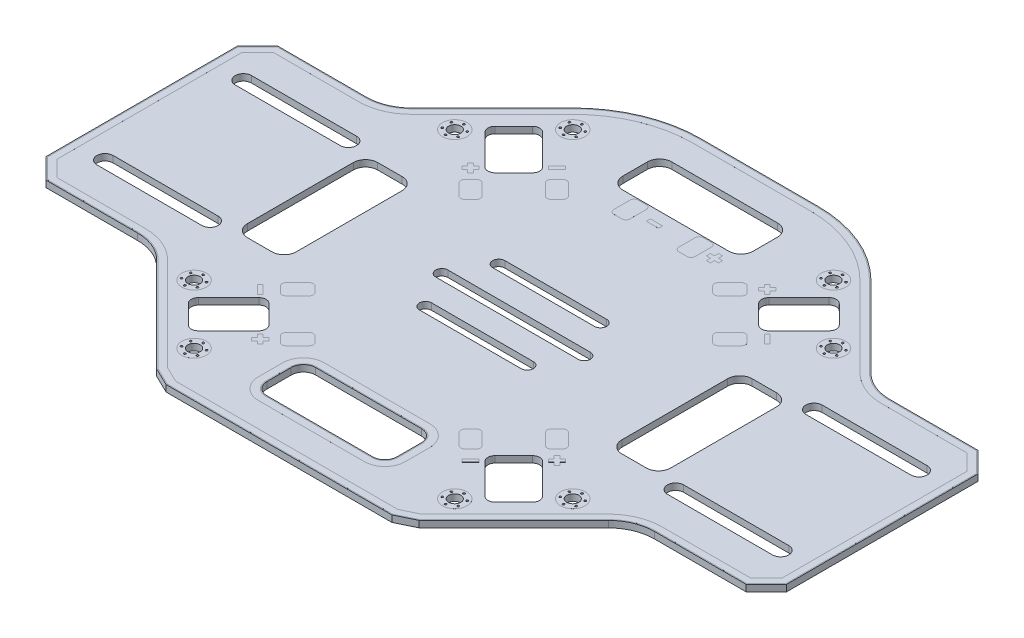
from build123d import *

# Parameters (mm, degrees)
BOSS_EXTRUDE1_DEPTH      = 0.8
BOSS_EXTRUDE1_DEPTH_BACK = 0.8
SKETCH1_R                = 1.5
SKETCH2_R                = 3
SKETCH2_R_2              = 0.25
SKETCH2_R_3              = 1.5
BOSS_EXTRUDE2_DEPTH      = 0.001
BOSS_EXTRUDE4_DEPTH      = 0.001
SKETCH6_R                = 0.25
CUT_EXTRUDE2_DEPTH       = 1.6
SKETCH7_W                = 3
SKETCH7_H                = 1
BOSS_EXTRUDE5_DEPTH      = 0.001


with BuildPart() as part:
    # Sketch1 → Boss-Extrude1 (new, two sides: drawn at the far end of the back side and taken through both)
    with BuildSketch(Plane(origin=(0, 0, 0), x_dir=(1, 0, 0), z_dir=(0, 1, 0)).offset(-BOSS_EXTRUDE1_DEPTH_BACK)):
        with BuildLine():
            Line((-27.75, -57.681401017), (27.75, -57.681401017))
            Line((27.75, -57.681401017), (32.25, -55.501951545))
            Line((32.25, -55.501951545), (55.501951545, -32.25))
            ThreePointArc((55.501951545, -32.25), (59.171487368, -29.798094552), (63.5, -28.937099858))
            Line((63.5, -28.937099858), (86, -28.937099858))
            Line((86, -28.937099858), (91, -23.937099858))
            Line((91, -23.937099858), (91, 23.062900142))
            Line((91, 23.062900142), (86, 28.062900142))
            Line((86, 28.062900142), (64.302117422, 28.062900142))
            ThreePointArc((64.302117422, 28.062900142), (60.040200145, 28.910648198), (56.427121139, 31.324830407))
            Line((56.427121139, 31.324830407), (36.628131265, 51.12382028))
            ThreePointArc((36.628131265, 51.12382028), (26.443529141, 57.928953855), (14.429971817, 60.318598983))
            Line((14.429971817, 60.318598983), (-14.429971817, 60.318598983))
            ThreePointArc((-14.429971817, 60.318598983), (-26.443529141, 57.928953855), (-36.628131265, 51.12382028))
            Line((-36.628131265, 51.12382028), (-56.427121139, 31.324830407))
            ThreePointArc((-56.427121139, 31.324830407), (-60.040200145, 28.910648198), (-64.302117422, 28.062900142))
            Line((-64.302117422, 28.062900142), (-86, 28.062900142))
            Line((-86, 28.062900142), (-91, 23.062900142))
            Line((-91, 23.062900142), (-91, -23.937099858))
            Line((-91, -23.937099858), (-86, -28.937099858))
            Line((-86, -28.937099858), (-63.5, -28.937099858))
            ThreePointArc((-63.5, -28.937099858), (-59.171487368, -29.798094552), (-55.501951545, -32.25))
            Line((-55.501951545, -32.25), (-32.25, -55.501951545))
            Line((-32.25, -55.501951545), (-27.75, -57.681401017))
        make_face()
        with Locations(Location((-32.031937188, 46.527626202, 0), (0, 0, 270))):
            Circle(SKETCH1_R, mode=Mode.SUBTRACT)
        with Locations(Location((-46.527626202, 32.031937188, 0), (0, 0, 270))):
            Circle(SKETCH1_R, mode=Mode.SUBTRACT)
        with Locations(Location((32.031937188, -46.527626202, 0), (0, 0, 270))):
            Circle(SKETCH1_R, mode=Mode.SUBTRACT)
        with Locations(Location((46.527626202, -32.031937188, 0), (0, 0, 270))):
            Circle(SKETCH1_R, mode=Mode.SUBTRACT)
        with Locations(Location((-46.527626202, -32.031937188, 0), (0, 0, 270))):
            Circle(SKETCH1_R, mode=Mode.SUBTRACT)
        with Locations(Location((-32.031937188, -46.527626202, 0), (0, 0, 270))):
            Circle(SKETCH1_R, mode=Mode.SUBTRACT)
        with Locations(Location((32.031937188, 46.527626202, 0), (0, 0, 270))):
            Circle(SKETCH1_R, mode=Mode.SUBTRACT)
        with Locations(Location((46.527626202, 32.031937188, 0), (0, 0, 270))):
            Circle(SKETCH1_R, mode=Mode.SUBTRACT)
        with BuildLine():
            Line((-13, -47.681401017), (13, -47.681401017))
            ThreePointArc((13, -47.681401017), (15.121320344, -46.802721361), (16, -44.681401017))
            Line((16, -44.681401017), (16, -38.681401017))
            ThreePointArc((16, -38.681401017), (15.121320344, -36.560080673), (13, -35.681401017))
            Line((13, -35.681401017), (-13, -35.681401017))
            ThreePointArc((-13, -35.681401017), (-15.121320344, -36.560080673), (-16, -38.681401017))
            Line((-16, -38.681401017), (-16, -44.681401017))
            ThreePointArc((-16, -44.681401017), (-15.121320344, -46.802721361), (-13, -47.681401017))
        make_face(mode=Mode.SUBTRACT)
        with BuildLine():
            Line((37.688791437, -42.284985515), (42.284985515, -37.688791437))
            ThreePointArc((42.284985515, -37.688791437), (42.797548648, -36.45135457), (42.284985515, -35.213917703))
            Line((42.284985515, -35.213917703), (34.860364312, -27.789296501))
            ThreePointArc((34.860364312, -27.789296501), (33.622927445, -27.276733368), (32.385490578, -27.789296501))
            Line((32.385490578, -27.789296501), (27.789296501, -32.385490578))
            ThreePointArc((27.789296501, -32.385490578), (27.276733368, -33.622927445), (27.789296501, -34.860364312))
            Line((27.789296501, -34.860364312), (35.213917703, -42.284985515))
            ThreePointArc((35.213917703, -42.284985515), (36.45135457, -42.797548648), (37.688791437, -42.284985515))
        make_face(mode=Mode.SUBTRACT)
        with BuildLine():
            Line((-35.213917703, -42.284985515), (-27.789296501, -34.860364312))
            ThreePointArc((-27.789296501, -34.860364312), (-27.276733368, -33.622927445), (-27.789296501, -32.385490578))
            Line((-27.789296501, -32.385490578), (-32.385490578, -27.789296501))
            ThreePointArc((-32.385490578, -27.789296501), (-33.622927445, -27.276733368), (-34.860364312, -27.789296501))
            Line((-34.860364312, -27.789296501), (-42.284985515, -35.213917703))
            ThreePointArc((-42.284985515, -35.213917703), (-42.797548648, -36.45135457), (-42.284985515, -37.688791437))
            Line((-42.284985515, -37.688791437), (-37.688791437, -42.284985515))
            ThreePointArc((-37.688791437, -42.284985515), (-36.45135457, -42.797548648), (-35.213917703, -42.284985515))
        make_face(mode=Mode.SUBTRACT)
        with BuildLine():
            Line((-35.213917703, 42.284985515), (-27.789296501, 34.860364312))
            ThreePointArc((-27.789296501, 34.860364312), (-27.276733368, 33.622927445), (-27.789296501, 32.385490578))
            Line((-27.789296501, 32.385490578), (-32.385490578, 27.789296501))
            ThreePointArc((-32.385490578, 27.789296501), (-33.622927445, 27.276733368), (-34.860364312, 27.789296501))
            Line((-34.860364312, 27.789296501), (-42.284985515, 35.213917703))
            ThreePointArc((-42.284985515, 35.213917703), (-42.797548648, 36.45135457), (-42.284985515, 37.688791437))
            Line((-42.284985515, 37.688791437), (-37.688791437, 42.284985515))
            ThreePointArc((-37.688791437, 42.284985515), (-36.45135457, 42.797548648), (-35.213917703, 42.284985515))
        make_face(mode=Mode.SUBTRACT)
        with BuildLine():
            Line((37.688791437, 42.284985515), (42.284985515, 37.688791437))
            ThreePointArc((42.284985515, 37.688791437), (42.797548648, 36.45135457), (42.284985515, 35.213917703))
            Line((42.284985515, 35.213917703), (34.860364312, 27.789296501))
            ThreePointArc((34.860364312, 27.789296501), (33.622927445, 27.276733368), (32.385490578, 27.789296501))
            Line((32.385490578, 27.789296501), (27.789296501, 32.385490578))
            ThreePointArc((27.789296501, 32.385490578), (27.276733368, 33.622927445), (27.789296501, 34.860364312))
            Line((27.789296501, 34.860364312), (35.213917703, 42.284985515))
            ThreePointArc((35.213917703, 42.284985515), (36.45135457, 42.797548648), (37.688791437, 42.284985515))
        make_face(mode=Mode.SUBTRACT)
        with BuildLine():
            Line((-13, 51.818598983), (13, 51.818598983))
            ThreePointArc((13, 51.818598983), (15.121320344, 50.939919327), (16, 48.818598983))
            Line((16, 48.818598983), (16, 42.818598983))
            ThreePointArc((16, 42.818598983), (15.121320344, 40.697278639), (13, 39.818598983))
            Line((13, 39.818598983), (-13, 39.818598983))
            ThreePointArc((-13, 39.818598983), (-15.121320344, 40.697278639), (-16, 42.818598983))
            Line((-16, 42.818598983), (-16, 48.818598983))
            ThreePointArc((-16, 48.818598983), (-15.121320344, 50.939919327), (-13, 51.818598983))
        make_face(mode=Mode.SUBTRACT)
        with BuildLine():
            Line((-12.5, -10.681401017), (12.5, -10.681401017))
            ThreePointArc((12.5, -10.681401017), (14, -9.181401017), (12.5, -7.681401017))
            Line((12.5, -7.681401017), (-12.5, -7.681401017))
            ThreePointArc((-12.5, -7.681401017), (-14, -9.181401017), (-12.5, -10.681401017))
        make_face(mode=Mode.SUBTRACT)
        with BuildLine():
            Line((-17.5, -1.681401017), (17.5, -1.681401017))
            ThreePointArc((17.5, -1.681401017), (19, -0.181401017), (17.5, 1.318598983))
            Line((17.5, 1.318598983), (-17.5, 1.318598983))
            ThreePointArc((-17.5, 1.318598983), (-19, -0.181401017), (-17.5, -1.681401017))
        make_face(mode=Mode.SUBTRACT)
        with BuildLine():
            Line((-12.5, 7.318598983), (12.5, 7.318598983))
            ThreePointArc((12.5, 7.318598983), (14, 8.818598983), (12.5, 10.318598983))
            Line((12.5, 10.318598983), (-12.5, 10.318598983))
            ThreePointArc((-12.5, 10.318598983), (-14, 8.818598983), (-12.5, 7.318598983))
        make_face(mode=Mode.SUBTRACT)
        with BuildLine():
            Line((-52, 12.562900142), (-52, -13.437099858))
            ThreePointArc((-52, -13.437099858), (-51.121320344, -15.558420201), (-49, -16.437099858))
            Line((-49, -16.437099858), (-43, -16.437099858))
            ThreePointArc((-43, -16.437099858), (-40.878679656, -15.558420201), (-40, -13.437099858))
            Line((-40, -13.437099858), (-40, 12.562900142))
            ThreePointArc((-40, 12.562900142), (-40.878679656, 14.684220486), (-43, 15.562900142))
            Line((-43, 15.562900142), (-49, 15.562900142))
            ThreePointArc((-49, 15.562900142), (-51.121320344, 14.684220486), (-52, 12.562900142))
        make_face(mode=Mode.SUBTRACT)
        with BuildLine():
            Line((52, 12.562900142), (52, -13.437099858))
            ThreePointArc((52, -13.437099858), (51.121320344, -15.558420201), (49, -16.437099858))
            Line((49, -16.437099858), (43, -16.437099858))
            ThreePointArc((43, -16.437099858), (40.878679656, -15.558420201), (40, -13.437099858))
            Line((40, -13.437099858), (40, 12.562900142))
            ThreePointArc((40, 12.562900142), (40.878679656, 14.684220486), (43, 15.562900142))
            Line((43, 15.562900142), (49, 15.562900142))
            ThreePointArc((49, 15.562900142), (51.121320344, 14.684220486), (52, 12.562900142))
        make_face(mode=Mode.SUBTRACT)
        with BuildLine():
            Line((-83, 18.562900142), (-57.2, 18.562900142))
            ThreePointArc((-57.2, 18.562900142), (-55.2, 16.562900142), (-57.2, 14.562900142))
            Line((-57.2, 14.562900142), (-83, 14.562900142))
            ThreePointArc((-83, 14.562900142), (-85, 16.562900142), (-83, 18.562900142))
        make_face(mode=Mode.SUBTRACT)
        with BuildLine():
            Line((-83, -15.437099858), (-57.2, -15.437099858))
            ThreePointArc((-57.2, -15.437099858), (-55.2, -17.437099858), (-57.2, -19.437099858))
            Line((-57.2, -19.437099858), (-83, -19.437099858))
            ThreePointArc((-83, -19.437099858), (-85, -17.437099858), (-83, -15.437099858))
        make_face(mode=Mode.SUBTRACT)
        with BuildLine():
            Line((57.2, -15.437099858), (83, -15.437099858))
            ThreePointArc((83, -15.437099858), (85, -17.437099858), (83, -19.437099858))
            Line((83, -19.437099858), (57.2, -19.437099858))
            ThreePointArc((57.2, -19.437099858), (55.2, -17.437099858), (57.2, -15.437099858))
        make_face(mode=Mode.SUBTRACT)
        with BuildLine():
            Line((57.2, 18.562900142), (83, 18.562900142))
            ThreePointArc((83, 18.562900142), (85, 16.562900142), (83, 14.562900142))
            Line((83, 14.562900142), (57.2, 14.562900142))
            ThreePointArc((57.2, 14.562900142), (55.2, 16.562900142), (57.2, 18.562900142))
        make_face(mode=Mode.SUBTRACT)
    extrude(amount=BOSS_EXTRUDE1_DEPTH + BOSS_EXTRUDE1_DEPTH_BACK)

    # Sketch2 → Boss-Extrude2 (add)
    # profile 1 of 10: a face of its own
    with BuildSketch(Plane(origin=(0, 0.8, 0), x_dir=(1, 0, 0), z_dir=(0, 1, 0))):
        with BuildLine():
            ThreePointArc((56.250344443, 31.148053711), (59.944529287, 28.679678315), (64.302117422, 27.812900142))
            Line((64.302117422, 27.812900142), (85.896446609, 27.812900142))
            Line((85.896446609, 27.812900142), (90.75, 22.959346752))
            Line((90.75, 22.959346752), (90.75, -23.833546467))
            Line((90.75, -23.833546467), (85.896446609, -28.687099858))
            Line((85.896446609, -28.687099858), (63.5, -28.687099858))
            ThreePointArc((63.5, -28.687099858), (59.075816509, -29.567124669), (55.32517485, -32.073223305))
            Line((55.32517485, -32.073223305), (32.10305631, -55.295341845))
            Line((32.10305631, -55.295341845), (27.692646067, -57.431401017))
            Line((27.692646067, -57.431401017), (-27.692646067, -57.431401017))
            Line((-27.692646067, -57.431401017), (-32.10305631, -55.295341845))
            Line((-32.10305631, -55.295341845), (-55.32517485, -32.073223305))
            ThreePointArc((-55.32517485, -32.073223305), (-59.075816509, -29.567124669), (-63.5, -28.687099858))
            Line((-63.5, -28.687099858), (-85.896446609, -28.687099858))
            Line((-85.896446609, -28.687099858), (-90.75, -23.833546467))
            Line((-90.75, -23.833546467), (-90.75, 22.959346752))
            Line((-90.75, 22.959346752), (-85.896446609, 27.812900142))
            Line((-85.896446609, 27.812900142), (-64.302117422, 27.812900142))
            ThreePointArc((-64.302117422, 27.812900142), (-59.944529287, 28.679678315), (-56.250344443, 31.148053711))
            Line((-56.250344443, 31.148053711), (-36.45135457, 50.947043584))
            ThreePointArc((-36.45135457, 50.947043584), (-26.347858283, 57.697983972), (-14.429971817, 60.068598983))
            Line((-14.429971817, 60.068598983), (14.429971817, 60.068598983))
            ThreePointArc((14.429971817, 60.068598983), (26.347858283, 57.697983972), (36.45135457, 50.947043584))
            Line((36.45135457, 50.947043584), (56.250344443, 31.148053711))
        make_face()
        with BuildLine():
            Line((-85.212994231, 26.162900142), (-64.302117422, 26.162900142))
            ThreePointArc((-64.302117422, 26.162900142), (-59.313101623, 27.155277086), (-55.083618254, 29.981327522))
            Line((-55.083618254, 29.981327522), (-35.284628381, 49.780317396))
            ThreePointArc((-35.284628381, 49.780317396), (-25.71643062, 56.173582743), (-14.429971817, 58.418598983))
            Line((-14.429971817, 58.418598983), (14.429971817, 58.418598983))
            ThreePointArc((14.429971817, 58.418598983), (25.71643062, 56.173582743), (35.284628381, 49.780317396))
            Line((35.284628381, 49.780317396), (55.083618254, 29.981327522))
            ThreePointArc((55.083618254, 29.981327522), (59.313101623, 27.155277086), (64.302117422, 26.162900142))
            Line((64.302117422, 26.162900142), (85.212994231, 26.162900142))
            Line((85.212994231, 26.162900142), (89.1, 22.275894374))
            Line((89.1, 22.275894374), (89.1, -23.150094089))
            Line((89.1, -23.150094089), (85.212994231, -27.037099858))
            Line((85.212994231, -27.037099858), (63.5, -27.037099858))
            ThreePointArc((63.5, -27.037099858), (58.444388846, -28.042723441), (54.158448661, -30.906497116))
            Line((54.158448661, -30.906497116), (31.133227955, -53.931717821))
            Line((31.133227955, -53.931717821), (27.314110106, -55.781401017))
            Line((27.314110106, -55.781401017), (-27.314110106, -55.781401017))
            Line((-27.314110106, -55.781401017), (-31.133227955, -53.931717821))
            Line((-31.133227955, -53.931717821), (-54.158448661, -30.906497116))
            ThreePointArc((-54.158448661, -30.906497116), (-58.444388846, -28.042723441), (-63.5, -27.037099858))
            Line((-63.5, -27.037099858), (-85.212994231, -27.037099858))
            Line((-85.212994231, -27.037099858), (-89.1, -23.150094089))
            Line((-89.1, -23.150094089), (-89.1, 22.275894374))
            Line((-89.1, 22.275894374), (-85.212994231, 26.162900142))
        make_face(mode=Mode.SUBTRACT)
    # profile 2 of 10: a face of its own
    with BuildSketch(Plane(origin=(0, 0.8, 0), x_dir=(1, 0, 0), z_dir=(0, 1, 0))):
        with Locations(Location((-32.031937188, -46.527626202, 0), (0, 0, 270))):
            Circle(SKETCH2_R)
        with Locations(Location((-33.980494346, -45.402626202, 0), (0, 0, 270))):
            Circle(SKETCH2_R_2, mode=Mode.SUBTRACT)
        with Locations(Location((-33.980494346, -47.652626202, 0), (0, 0, 270))):
            Circle(SKETCH2_R_2, mode=Mode.SUBTRACT)
        with Locations(Location((-32.031937188, -48.777626202, 0), (0, 0, 270))):
            Circle(SKETCH2_R_2, mode=Mode.SUBTRACT)
        with Locations(Location((-30.083380029, -47.652626202, 0), (0, 0, 270))):
            Circle(SKETCH2_R_2, mode=Mode.SUBTRACT)
        with Locations(Location((-30.083380029, -45.402626202, 0), (0, 0, 270))):
            Circle(SKETCH2_R_2, mode=Mode.SUBTRACT)
        with Locations(Location((-32.031937188, -44.277626202, 0), (0, 0, 270))):
            Circle(SKETCH2_R_2, mode=Mode.SUBTRACT)
        with Locations(Location((-32.031937188, -46.527626202, 0), (0, 0, 270))):
            Circle(SKETCH2_R_3, mode=Mode.SUBTRACT)
    # profile 3 of 10: a face of its own
    with BuildSketch(Plane(origin=(0, 0.8, 0), x_dir=(1, 0, 0), z_dir=(0, 1, 0))):
        with Locations(Location((-46.527626202, -32.031937188, 0), (0, 0, 270))):
            Circle(SKETCH2_R)
        with Locations(Location((-48.476183361, -30.906937188, 0), (0, 0, 270))):
            Circle(SKETCH2_R_2, mode=Mode.SUBTRACT)
        with Locations(Location((-48.476183361, -33.156937188, 0), (0, 0, 270))):
            Circle(SKETCH2_R_2, mode=Mode.SUBTRACT)
        with Locations(Location((-46.527626202, -34.281937188, 0), (0, 0, 270))):
            Circle(SKETCH2_R_2, mode=Mode.SUBTRACT)
        with Locations(Location((-44.579069044, -33.156937188, 0), (0, 0, 270))):
            Circle(SKETCH2_R_2, mode=Mode.SUBTRACT)
        with Locations(Location((-44.579069044, -30.906937188, 0), (0, 0, 270))):
            Circle(SKETCH2_R_2, mode=Mode.SUBTRACT)
        with Locations(Location((-46.527626202, -29.781937188, 0), (0, 0, 270))):
            Circle(SKETCH2_R_2, mode=Mode.SUBTRACT)
        with Locations(Location((-46.527626202, -32.031937188, 0), (0, 0, 270))):
            Circle(SKETCH2_R_3, mode=Mode.SUBTRACT)
    # profile 4 of 10: a face of its own
    with BuildSketch(Plane(origin=(0, 0.8, 0), x_dir=(1, 0, 0), z_dir=(0, 1, 0))):
        with Locations(Location((-46.527626202, 32.031937188, 0), (0, 0, 270))):
            Circle(SKETCH2_R)
        with Locations(Location((-48.476183361, 30.906937188, 0), (0, 0, 270))):
            Circle(SKETCH2_R_2, mode=Mode.SUBTRACT)
        with Locations(Location((-48.476183361, 33.156937188, 0), (0, 0, 270))):
            Circle(SKETCH2_R_2, mode=Mode.SUBTRACT)
        with Locations(Location((-46.527626202, 34.281937188, 0), (0, 0, 270))):
            Circle(SKETCH2_R_2, mode=Mode.SUBTRACT)
        with Locations(Location((-44.579069044, 33.156937188, 0), (0, 0, 270))):
            Circle(SKETCH2_R_2, mode=Mode.SUBTRACT)
        with Locations(Location((-44.579069044, 30.906937188, 0), (0, 0, 270))):
            Circle(SKETCH2_R_2, mode=Mode.SUBTRACT)
        with Locations(Location((-46.527626202, 29.781937188, 0), (0, 0, 270))):
            Circle(SKETCH2_R_2, mode=Mode.SUBTRACT)
        with Locations(Location((-46.527626202, 32.031937188, 0), (0, 0, 270))):
            Circle(SKETCH2_R_3, mode=Mode.SUBTRACT)
    # profile 5 of 10: a face of its own
    with BuildSketch(Plane(origin=(0, 0.8, 0), x_dir=(1, 0, 0), z_dir=(0, 1, 0))):
        with Locations(Location((-32.031937188, 46.527626202, 0), (0, 0, 270))):
            Circle(SKETCH2_R)
        with Locations(Location((-33.980494346, 45.402626202, 0), (0, 0, 270))):
            Circle(SKETCH2_R_2, mode=Mode.SUBTRACT)
        with Locations(Location((-33.980494346, 47.652626202, 0), (0, 0, 270))):
            Circle(SKETCH2_R_2, mode=Mode.SUBTRACT)
        with Locations(Location((-32.031937188, 44.277626202, 0), (0, 0, 270))):
            Circle(SKETCH2_R_2, mode=Mode.SUBTRACT)
        with Locations(Location((-30.083380029, 45.402626202, 0), (0, 0, 270))):
            Circle(SKETCH2_R_2, mode=Mode.SUBTRACT)
        with Locations(Location((-30.083380029, 47.652626202, 0), (0, 0, 270))):
            Circle(SKETCH2_R_2, mode=Mode.SUBTRACT)
        with Locations(Location((-32.031937188, 48.777626202, 0), (0, 0, 270))):
            Circle(SKETCH2_R_2, mode=Mode.SUBTRACT)
        with Locations(Location((-32.031937188, 46.527626202, 0), (0, 0, 270))):
            Circle(SKETCH2_R_3, mode=Mode.SUBTRACT)
    # profile 6 of 10: a face of its own
    with BuildSketch(Plane(origin=(0, 0.8, 0), x_dir=(1, 0, 0), z_dir=(0, 1, 0))):
        with Locations(Location((32.031937188, 46.527626202, 0), (0, 0, 270))):
            Circle(SKETCH2_R)
        with Locations(Location((30.083380029, 45.402626202, 0), (0, 0, 270))):
            Circle(SKETCH2_R_2, mode=Mode.SUBTRACT)
        with Locations(Location((30.083380029, 47.652626202, 0), (0, 0, 270))):
            Circle(SKETCH2_R_2, mode=Mode.SUBTRACT)
        with Locations(Location((32.031937188, 48.777626202, 0), (0, 0, 270))):
            Circle(SKETCH2_R_2, mode=Mode.SUBTRACT)
        with Locations(Location((33.980494346, 47.652626202, 0), (0, 0, 270))):
            Circle(SKETCH2_R_2, mode=Mode.SUBTRACT)
        with Locations(Location((33.980494346, 45.402626202, 0), (0, 0, 270))):
            Circle(SKETCH2_R_2, mode=Mode.SUBTRACT)
        with Locations(Location((32.031937188, 44.277626202, 0), (0, 0, 270))):
            Circle(SKETCH2_R_2, mode=Mode.SUBTRACT)
        with Locations(Location((32.031937188, 46.527626202, 0), (0, 0, 270))):
            Circle(SKETCH2_R_3, mode=Mode.SUBTRACT)
    # profile 7 of 10: a face of its own
    with BuildSketch(Plane(origin=(0, 0.8, 0), x_dir=(1, 0, 0), z_dir=(0, 1, 0))):
        with Locations(Location((46.527626202, 32.031937188, 0), (0, 0, 270))):
            Circle(SKETCH2_R)
        with Locations(Location((44.579069044, 30.906937188, 0), (0, 0, 270))):
            Circle(SKETCH2_R_2, mode=Mode.SUBTRACT)
        with Locations(Location((44.579069044, 33.156937188, 0), (0, 0, 270))):
            Circle(SKETCH2_R_2, mode=Mode.SUBTRACT)
        with Locations(Location((46.527626202, 34.281937188, 0), (0, 0, 270))):
            Circle(SKETCH2_R_2, mode=Mode.SUBTRACT)
        with Locations(Location((48.476183361, 33.156937188, 0), (0, 0, 270))):
            Circle(SKETCH2_R_2, mode=Mode.SUBTRACT)
        with Locations(Location((48.476183361, 30.906937188, 0), (0, 0, 270))):
            Circle(SKETCH2_R_2, mode=Mode.SUBTRACT)
        with Locations(Location((46.527626202, 29.781937188, 0), (0, 0, 270))):
            Circle(SKETCH2_R_2, mode=Mode.SUBTRACT)
        with Locations(Location((46.527626202, 32.031937188, 0), (0, 0, 270))):
            Circle(SKETCH2_R_3, mode=Mode.SUBTRACT)
    # profile 8 of 10: a face of its own
    with BuildSketch(Plane(origin=(0, 0.8, 0), x_dir=(1, 0, 0), z_dir=(0, 1, 0))):
        with Locations(Location((46.527626202, -32.031937188, 0), (0, 0, 270))):
            Circle(SKETCH2_R)
        with Locations(Location((44.579069044, -33.156937188, 0), (0, 0, 270))):
            Circle(SKETCH2_R_2, mode=Mode.SUBTRACT)
        with Locations(Location((44.579069044, -30.906937188, 0), (0, 0, 270))):
            Circle(SKETCH2_R_2, mode=Mode.SUBTRACT)
        with Locations(Location((46.527626202, -29.781937188, 0), (0, 0, 270))):
            Circle(SKETCH2_R_2, mode=Mode.SUBTRACT)
        with Locations(Location((48.476183361, -30.906937188, 0), (0, 0, 270))):
            Circle(SKETCH2_R_2, mode=Mode.SUBTRACT)
        with Locations(Location((48.476183361, -33.156937188, 0), (0, 0, 270))):
            Circle(SKETCH2_R_2, mode=Mode.SUBTRACT)
        with Locations(Location((46.527626202, -34.281937188, 0), (0, 0, 270))):
            Circle(SKETCH2_R_2, mode=Mode.SUBTRACT)
        with Locations(Location((46.527626202, -32.031937188, 0), (0, 0, 270))):
            Circle(SKETCH2_R_3, mode=Mode.SUBTRACT)
    # profile 9 of 10: a face of its own
    with BuildSketch(Plane(origin=(0, 0.8, 0), x_dir=(1, 0, 0), z_dir=(0, 1, 0))):
        with Locations(Location((32.031937188, -46.527626202, 0), (0, 0, 270))):
            Circle(SKETCH2_R)
        with Locations(Location((30.083380029, -45.402626202, 0), (0, 0, 270))):
            Circle(SKETCH2_R_2, mode=Mode.SUBTRACT)
        with Locations(Location((30.083380029, -47.652626202, 0), (0, 0, 270))):
            Circle(SKETCH2_R_2, mode=Mode.SUBTRACT)
        with Locations(Location((32.031937188, -48.777626202, 0), (0, 0, 270))):
            Circle(SKETCH2_R_2, mode=Mode.SUBTRACT)
        with Locations(Location((33.980494346, -47.652626202, 0), (0, 0, 270))):
            Circle(SKETCH2_R_2, mode=Mode.SUBTRACT)
        with Locations(Location((33.980494346, -45.402626202, 0), (0, 0, 270))):
            Circle(SKETCH2_R_2, mode=Mode.SUBTRACT)
        with Locations(Location((32.031937188, -44.277626202, 0), (0, 0, 270))):
            Circle(SKETCH2_R_2, mode=Mode.SUBTRACT)
        with Locations(Location((32.031937188, -46.527626202, 0), (0, 0, 270))):
            Circle(SKETCH2_R_3, mode=Mode.SUBTRACT)
    # profile 10 of 10: a face of its own
    with BuildSketch(Plane(origin=(0, 0.8, 0), x_dir=(1, 0, 0), z_dir=(0, 1, 0))):
        with BuildLine():
            Line((-13, -33.631401017), (13, -33.631401017))
            ThreePointArc((13, -33.631401017), (16.570889245, -35.110511772), (18.05, -38.681401017))
            Line((18.05, -38.681401017), (18.05, -44.681401017))
            ThreePointArc((18.05, -44.681401017), (16.570889245, -48.252290262), (13, -49.731401017))
            Line((13, -49.731401017), (-13, -49.731401017))
            ThreePointArc((-13, -49.731401017), (-16.570889245, -48.252290262), (-18.05, -44.681401017))
            Line((-18.05, -44.681401017), (-18.05, -38.681401017))
            ThreePointArc((-18.05, -38.681401017), (-16.570889245, -35.110511772), (-13, -33.631401017))
        make_face()
        with BuildLine():
            ThreePointArc((13, -47.931401017), (15.298097039, -46.979498056), (16.25, -44.681401017))
            Line((16.25, -44.681401017), (16.25, -38.681401017))
            ThreePointArc((16.25, -38.681401017), (15.298097039, -36.383303978), (13, -35.431401017))
            Line((13, -35.431401017), (-13, -35.431401017))
            ThreePointArc((-13, -35.431401017), (-15.298097039, -36.383303978), (-16.25, -38.681401017))
            Line((-16.25, -38.681401017), (-16.25, -44.681401017))
            ThreePointArc((-16.25, -44.681401017), (-15.298097039, -46.979498056), (-13, -47.931401017))
            Line((-13, -47.931401017), (13, -47.931401017))
        make_face(mode=Mode.SUBTRACT)
    boss_extrude2 = extrude(amount=BOSS_EXTRUDE2_DEPTH)

    # Mirror1: Boss-Extrude2 across plane
    add(boss_extrude2.mirror(Plane.ZX))

    # Sketch5 → Boss-Extrude4 (add)
    with BuildSketch(Plane(origin=(0, 0.8, 0), x_dir=(1, 0, 0), z_dir=(0, 1, 0))):
        Polygon((35.744247789, -27.258966415), (36.45135457, -26.551859634), (37.158461351, -27.258966415), (37.865568133, -26.551859634), (37.158461351, -25.844752852), (37.865568133, -25.137646071), (37.158461351, -24.43053929), (36.45135457, -25.137646071), (35.744247789, -24.43053929), (35.037141008, -25.137646071), (35.744247789, -25.844752852), (35.037141008, -26.551859634), align=None)
        Polygon((26.551859634, -35.037141008), (27.258966415, -35.744247789), (25.137646071, -37.865568133), (24.43053929, -37.158461351), align=None)
        Polygon((-37.158461351, -24.43053929), (-37.865568133, -25.137646071), (-35.744247789, -27.258966415), (-35.037141008, -26.551859634), align=None)
        Polygon((-26.551859634, -35.037141008), (-27.258966415, -35.744247789), (-26.551859634, -36.45135457), (-27.258966415, -37.158461351), (-26.551859634, -37.865568133), (-25.844752852, -37.158461351), (-25.137646071, -37.865568133), (-24.43053929, -37.158461351), (-25.137646071, -36.45135457), (-24.43053929, -35.744247789), (-25.137646071, -35.037141008), (-25.844752852, -35.744247789), align=None)
        Polygon((-24.43053929, 37.158461351), (-25.137646071, 37.865568133), (-27.258966415, 35.744247789), (-26.551859634, 35.037141008), align=None)
        Polygon((-35.037141008, 26.551859634), (-35.744247789, 27.258966415), (-36.45135457, 26.551859634), (-37.158461351, 27.258966415), (-37.865568133, 26.551859634), (-37.158461351, 25.844752852), (-37.865568133, 25.137646071), (-37.158461351, 24.43053929), (-36.45135457, 25.137646071), (-35.744247789, 24.43053929), (-35.037141008, 25.137646071), (-35.744247789, 25.844752852), align=None)
        Polygon((37.158461351, 24.43053929), (37.865568133, 25.137646071), (35.744247789, 27.258966415), (35.037141008, 26.551859634), align=None)
        Polygon((26.551859634, 35.037141008), (27.258966415, 35.744247789), (26.551859634, 36.45135457), (27.258966415, 37.158461351), (26.551859634, 37.865568133), (25.844752852, 37.158461351), (25.137646071, 37.865568133), (24.43053929, 37.158461351), (25.137646071, 36.45135457), (24.43053929, 35.744247789), (25.137646071, 35.037141008), (25.844752852, 35.744247789), align=None)
        with BuildLine():
            Line((29.026733368, -19.834345212), (30.44094693, -18.42013165))
            ThreePointArc((30.44094693, -18.42013165), (31.148053711, -18.127238431), (31.855160492, -18.42013165))
            Line((31.855160492, -18.42013165), (34.683587617, -21.248558775))
            ThreePointArc((34.683587617, -21.248558775), (34.976480836, -21.955665556), (34.683587617, -22.662772337))
            Line((34.683587617, -22.662772337), (33.269374055, -24.076985899))
            ThreePointArc((33.269374055, -24.076985899), (32.562267274, -24.369879118), (31.855160492, -24.076985899))
            Line((31.855160492, -24.076985899), (29.026733368, -21.248558775))
            ThreePointArc((29.026733368, -21.248558775), (28.733840149, -20.541451993), (29.026733368, -19.834345212))
        make_face()
        with BuildLine():
            Line((18.42013165, -31.855160492), (21.248558775, -34.683587617))
            ThreePointArc((21.248558775, -34.683587617), (21.955665556, -34.976480836), (22.662772337, -34.683587617))
            Line((22.662772337, -34.683587617), (24.076985899, -33.269374055))
            ThreePointArc((24.076985899, -33.269374055), (24.369879118, -32.562267274), (24.076985899, -31.855160492))
            Line((24.076985899, -31.855160492), (21.248558775, -29.026733368))
            ThreePointArc((21.248558775, -29.026733368), (20.541451993, -28.733840149), (19.834345212, -29.026733368))
            Line((19.834345212, -29.026733368), (18.42013165, -30.44094693))
            ThreePointArc((18.42013165, -30.44094693), (18.127238431, -31.148053711), (18.42013165, -31.855160492))
        make_face()
        with BuildLine():
            Line((-34.683587617, -22.662772337), (-33.269374055, -24.076985899))
            ThreePointArc((-33.269374055, -24.076985899), (-32.562267274, -24.369879118), (-31.855160492, -24.076985899))
            Line((-31.855160492, -24.076985899), (-29.026733368, -21.248558775))
            ThreePointArc((-29.026733368, -21.248558775), (-28.733840149, -20.541451993), (-29.026733368, -19.834345212))
            Line((-29.026733368, -19.834345212), (-30.44094693, -18.42013165))
            ThreePointArc((-30.44094693, -18.42013165), (-31.148053711, -18.127238431), (-31.855160492, -18.42013165))
            Line((-31.855160492, -18.42013165), (-34.683587617, -21.248558775))
            ThreePointArc((-34.683587617, -21.248558775), (-34.976480836, -21.955665556), (-34.683587617, -22.662772337))
        make_face()
        with BuildLine():
            Line((-21.248558775, -29.026733368), (-24.076985899, -31.855160492))
            ThreePointArc((-24.076985899, -31.855160492), (-24.369879118, -32.562267274), (-24.076985899, -33.269374055))
            Line((-24.076985899, -33.269374055), (-22.662772337, -34.683587617))
            ThreePointArc((-22.662772337, -34.683587617), (-21.955665556, -34.976480836), (-21.248558775, -34.683587617))
            Line((-21.248558775, -34.683587617), (-18.42013165, -31.855160492))
            ThreePointArc((-18.42013165, -31.855160492), (-18.127238431, -31.148053711), (-18.42013165, -30.44094693))
            Line((-18.42013165, -30.44094693), (-19.834345212, -29.026733368))
            ThreePointArc((-19.834345212, -29.026733368), (-20.541451993, -28.733840149), (-21.248558775, -29.026733368))
        make_face()
        with BuildLine():
            Line((-22.662772337, 34.683587617), (-24.076985899, 33.269374055))
            ThreePointArc((-24.076985899, 33.269374055), (-24.369879118, 32.562267274), (-24.076985899, 31.855160492))
            Line((-24.076985899, 31.855160492), (-21.248558775, 29.026733368))
            ThreePointArc((-21.248558775, 29.026733368), (-20.541451993, 28.733840149), (-19.834345212, 29.026733368))
            Line((-19.834345212, 29.026733368), (-18.42013165, 30.44094693))
            ThreePointArc((-18.42013165, 30.44094693), (-18.127238431, 31.148053711), (-18.42013165, 31.855160492))
            Line((-18.42013165, 31.855160492), (-21.248558775, 34.683587617))
            ThreePointArc((-21.248558775, 34.683587617), (-21.955665556, 34.976480836), (-22.662772337, 34.683587617))
        make_face()
        with BuildLine():
            Line((-29.026733368, 21.248558775), (-31.855160492, 24.076985899))
            ThreePointArc((-31.855160492, 24.076985899), (-32.562267274, 24.369879118), (-33.269374055, 24.076985899))
            Line((-33.269374055, 24.076985899), (-34.683587617, 22.662772337))
            ThreePointArc((-34.683587617, 22.662772337), (-34.976480836, 21.955665556), (-34.683587617, 21.248558775))
            Line((-34.683587617, 21.248558775), (-31.855160492, 18.42013165))
            ThreePointArc((-31.855160492, 18.42013165), (-31.148053711, 18.127238431), (-30.44094693, 18.42013165))
            Line((-30.44094693, 18.42013165), (-29.026733368, 19.834345212))
            ThreePointArc((-29.026733368, 19.834345212), (-28.733840149, 20.541451993), (-29.026733368, 21.248558775))
        make_face()
        with BuildLine():
            Line((34.683587617, 22.662772337), (33.269374055, 24.076985899))
            ThreePointArc((33.269374055, 24.076985899), (32.562267274, 24.369879118), (31.855160492, 24.076985899))
            Line((31.855160492, 24.076985899), (29.026733368, 21.248558775))
            ThreePointArc((29.026733368, 21.248558775), (28.733840149, 20.541451993), (29.026733368, 19.834345212))
            Line((29.026733368, 19.834345212), (30.44094693, 18.42013165))
            ThreePointArc((30.44094693, 18.42013165), (31.148053711, 18.127238431), (31.855160492, 18.42013165))
            Line((31.855160492, 18.42013165), (34.683587617, 21.248558775))
            ThreePointArc((34.683587617, 21.248558775), (34.976480836, 21.955665556), (34.683587617, 22.662772337))
        make_face()
        with BuildLine():
            Line((21.248558775, 29.026733368), (24.076985899, 31.855160492))
            ThreePointArc((24.076985899, 31.855160492), (24.369879118, 32.562267274), (24.076985899, 33.269374055))
            Line((24.076985899, 33.269374055), (22.662772337, 34.683587617))
            ThreePointArc((22.662772337, 34.683587617), (21.955665556, 34.976480836), (21.248558775, 34.683587617))
            Line((21.248558775, 34.683587617), (18.42013165, 31.855160492))
            ThreePointArc((18.42013165, 31.855160492), (18.127238431, 31.148053711), (18.42013165, 30.44094693))
            Line((18.42013165, 30.44094693), (19.834345212, 29.026733368))
            ThreePointArc((19.834345212, 29.026733368), (20.541451993, 28.733840149), (21.248558775, 29.026733368))
        make_face()
    extrude(amount=BOSS_EXTRUDE4_DEPTH)

    # Sketch6 → Cut-Extrude2 (cut)
    with BuildSketch(Plane(origin=(0, 0.8, 0), x_dir=(1, 0, 0), z_dir=(0, 1, 0))):
        with Locations(Location((-48.476183361, 33.156937188, 0), (0, 0, 270))):
            Circle(SKETCH6_R)
        with Locations(Location((-46.527626202, 34.281937188, 0), (0, 0, 270))):
            Circle(SKETCH6_R)
        with Locations(Location((-44.579069044, 33.156937188, 0), (0, 0, 270))):
            Circle(SKETCH6_R)
        with Locations(Location((-48.476183361, 30.906937188, 0), (0, 0, 270))):
            Circle(SKETCH6_R)
        with Locations(Location((-46.527626202, 29.781937188, 0), (0, 0, 270))):
            Circle(SKETCH6_R)
        with Locations(Location((-44.579069044, 30.906937188, 0), (0, 0, 270))):
            Circle(SKETCH6_R)
        with Locations(Location((-33.980494346, 45.402626202, 0), (0, 0, 270))):
            Circle(SKETCH6_R)
        with Locations(Location((-32.031937188, 48.777626202, 0), (0, 0, 270))):
            Circle(SKETCH6_R)
        with Locations(Location((-33.980494346, 47.652626202, 0), (0, 0, 270))):
            Circle(SKETCH6_R)
        with Locations(Location((-32.031937188, 44.277626202, 0), (0, 0, 270))):
            Circle(SKETCH6_R)
        with Locations(Location((-30.083380029, 47.652626202, 0), (0, 0, 270))):
            Circle(SKETCH6_R)
        with Locations(Location((-30.083380029, 45.402626202, 0), (0, 0, 270))):
            Circle(SKETCH6_R)
        with Locations(Location((30.083380029, 47.652626202, 0), (0, 0, 270))):
            Circle(SKETCH6_R)
        with Locations(Location((32.031937188, 48.777626202, 0), (0, 0, 270))):
            Circle(SKETCH6_R)
        with Locations(Location((33.980494346, 47.652626202, 0), (0, 0, 270))):
            Circle(SKETCH6_R)
        with Locations(Location((33.980494346, 45.402626202, 0), (0, 0, 270))):
            Circle(SKETCH6_R)
        with Locations(Location((30.083380029, 45.402626202, 0), (0, 0, 270))):
            Circle(SKETCH6_R)
        with Locations(Location((32.031937188, 44.277626202, 0), (0, 0, 270))):
            Circle(SKETCH6_R)
        with Locations(Location((46.527626202, 34.281937188, 0), (0, 0, 270))):
            Circle(SKETCH6_R)
        with Locations(Location((48.476183361, 30.906937188, 0), (0, 0, 270))):
            Circle(SKETCH6_R)
        with Locations(Location((44.579069044, 33.156937188, 0), (0, 0, 270))):
            Circle(SKETCH6_R)
        with Locations(Location((48.476183361, 33.156937188, 0), (0, 0, 270))):
            Circle(SKETCH6_R)
        with Locations(Location((46.527626202, 29.781937188, 0), (0, 0, 270))):
            Circle(SKETCH6_R)
        with Locations(Location((44.579069044, 30.906937188, 0), (0, 0, 270))):
            Circle(SKETCH6_R)
        with Locations(Location((44.579069044, -30.906937188, 0), (0, 0, 270))):
            Circle(SKETCH6_R)
        with Locations(Location((46.527626202, -29.781937188, 0), (0, 0, 270))):
            Circle(SKETCH6_R)
        with Locations(Location((44.579069044, -33.156937188, 0), (0, 0, 270))):
            Circle(SKETCH6_R)
        with Locations(Location((48.476183361, -33.156937188, 0), (0, 0, 270))):
            Circle(SKETCH6_R)
        with Locations(Location((48.476183361, -30.906937188, 0), (0, 0, 270))):
            Circle(SKETCH6_R)
        with Locations(Location((46.527626202, -34.281937188, 0), (0, 0, 270))):
            Circle(SKETCH6_R)
        with Locations(Location((32.031937188, -44.277626202, 0), (0, 0, 270))):
            Circle(SKETCH6_R)
        with Locations(Location((30.083380029, -45.402626202, 0), (0, 0, 270))):
            Circle(SKETCH6_R)
        with Locations(Location((30.083380029, -47.652626202, 0), (0, 0, 270))):
            Circle(SKETCH6_R)
        with Locations(Location((33.980494346, -47.652626202, 0), (0, 0, 270))):
            Circle(SKETCH6_R)
        with Locations(Location((32.031937188, -48.777626202, 0), (0, 0, 270))):
            Circle(SKETCH6_R)
        with Locations(Location((33.980494346, -45.402626202, 0), (0, 0, 270))):
            Circle(SKETCH6_R)
        with Locations(Location((-48.476183361, -30.906937188, 0), (0, 0, 270))):
            Circle(SKETCH6_R)
        with Locations(Location((-44.579069044, -30.906937188, 0), (0, 0, 270))):
            Circle(SKETCH6_R)
        with Locations(Location((-48.476183361, -33.156937188, 0), (0, 0, 270))):
            Circle(SKETCH6_R)
        with Locations(Location((-46.527626202, -34.281937188, 0), (0, 0, 270))):
            Circle(SKETCH6_R)
        with Locations(Location((-44.579069044, -33.156937188, 0), (0, 0, 270))):
            Circle(SKETCH6_R)
        with Locations(Location((-46.527626202, -29.781937188, 0), (0, 0, 270))):
            Circle(SKETCH6_R)
        with Locations(Location((-33.980494346, -45.402626202, 0), (0, 0, 270))):
            Circle(SKETCH6_R)
        with Locations(Location((-32.031937188, -44.277626202, 0), (0, 0, 270))):
            Circle(SKETCH6_R)
        with Locations(Location((-30.083380029, -45.402626202, 0), (0, 0, 270))):
            Circle(SKETCH6_R)
        with Locations(Location((-30.083380029, -47.652626202, 0), (0, 0, 270))):
            Circle(SKETCH6_R)
        with Locations(Location((-33.980494346, -47.652626202, 0), (0, 0, 270))):
            Circle(SKETCH6_R)
        with Locations(Location((-32.031937188, -48.777626202, 0), (0, 0, 270))):
            Circle(SKETCH6_R)
    extrude(amount=-CUT_EXTRUDE2_DEPTH, mode=Mode.SUBTRACT)

    # Sketch7 → Boss-Extrude5 (add)
    with BuildSketch(Plane(origin=(0, 0.8, 0), x_dir=(1, 0, 0), z_dir=(0, 1, 0))):
        with BuildLine():
            Line((9, 39.568598983), (7, 39.568598983))
            ThreePointArc((7, 39.568598983), (6.292893219, 39.275705764), (6, 38.568598983))
            Line((6, 38.568598983), (6, 34.568598983))
            ThreePointArc((6, 34.568598983), (6.292893219, 33.861492202), (7, 33.568598983))
            Line((7, 33.568598983), (9, 33.568598983))
            ThreePointArc((9, 33.568598983), (9.707106781, 33.861492202), (10, 34.568598983))
            Line((10, 34.568598983), (10, 38.568598983))
            ThreePointArc((10, 38.568598983), (9.707106781, 39.275705764), (9, 39.568598983))
        make_face()
        with BuildLine():
            Line((-7, 39.568598983), (-9, 39.568598983))
            ThreePointArc((-9, 39.568598983), (-9.707106781, 39.275705764), (-10, 38.568598983))
            Line((-10, 38.568598983), (-10, 34.568598983))
            ThreePointArc((-10, 34.568598983), (-9.707106781, 33.861492202), (-9, 33.568598983))
            Line((-9, 33.568598983), (-7, 33.568598983))
            ThreePointArc((-7, 33.568598983), (-6.292893219, 33.861492202), (-6, 34.568598983))
            Line((-6, 34.568598983), (-6, 38.568598983))
            ThreePointArc((-6, 38.568598983), (-6.292893219, 39.275705764), (-7, 39.568598983))
        make_face()
        with Locations((-2, 36.568598983)):
            Rectangle(SKETCH7_W, SKETCH7_H)
        Polygon((14.25, 36.068598983), (13.25, 36.068598983), (13.25, 35.068598983), (12.25, 35.068598983), (12.25, 36.068598983), (11.25, 36.068598983), (11.25, 37.068598983), (12.25, 37.068598983), (12.25, 38.068598983), (13.25, 38.068598983), (13.25, 37.068598983), (14.25, 37.068598983), align=None)
    extrude(amount=BOSS_EXTRUDE5_DEPTH)


solid = part.part
